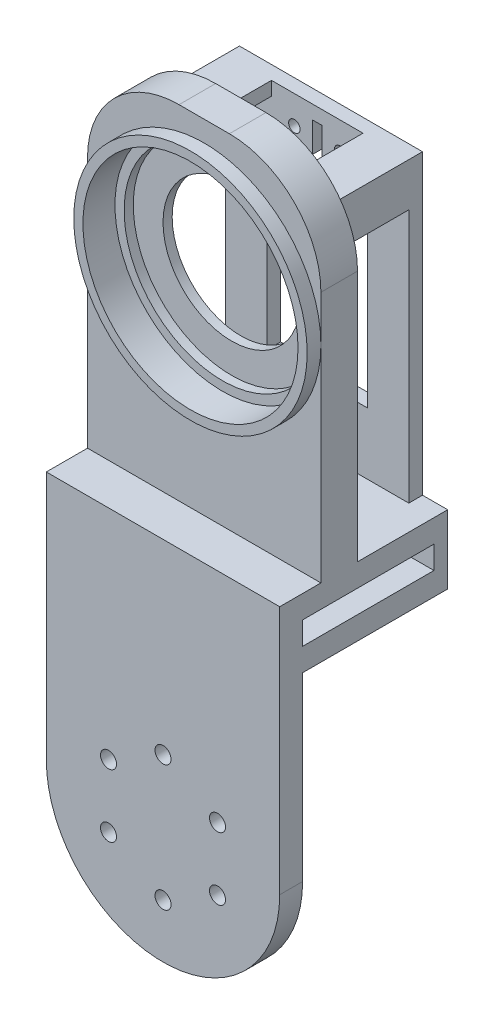
from build123d import *

# Parameters (mm, degrees)
EXTRUDE_1_DEPTH     = 5
SKETCH_2_R          = 17.5
CUT_EXTRUDE_1_DEPTH = 2
SKETCH_3_R          = 1.75
CUT_EXTRUDE_2_DEPTH = 61.245331769
SKETCH_4_W          = 51
SKETCH_4_H          = 5
EXTRUDE_2_DEPTH     = 31.7
SKETCH_12_W         = 51
SKETCH_12_H         = 8
EXTRUDE_7_DEPTH     = 75
FILLET_2_R          = 20
CUT_EXTRUDE_6_REACH = 135.449
SKETCH_13_R         = 15
SKETCH_14_R         = 25.5
EXTRUDE_8_DEPTH     = 3
SKETCH_16_R         = 23.5
CUT_EXTRUDE_7_DEPTH = 7
SKETCH_17_R         = 21.5
CUT_EXTRUDE_8_DEPTH = 2
EXTRUDE_9_DEPTH     = 19.7
EXTRUDE_10_DEPTH    = 3
CUT_EXTRUDE_9_REACH = 138.994
SKETCH_20_R         = 1.25


with BuildPart() as part:
    # 스케치1 → 보스-돌출1 (new body)
    with BuildSketch(Plane.XY):
        with BuildLine():
            Line((-25.5, 0), (-25.5, 54.5))
            Line((-25.5, 54.5), (25.5, 54.5))
            Line((25.5, 54.5), (25.5, 0))
            ThreePointArc((25.5, 0), (0, -25.5), (-25.5, 0))
        make_face()
    extrude(amount=EXTRUDE_1_DEPTH)

    # 스케치2 → 컷-돌출1 (cut)
    with BuildSketch(Plane(origin=(0, 0, 0), x_dir=(-1, 0, 0), z_dir=(0, 0, -1))):
        Circle(SKETCH_2_R)
    extrude(amount=-CUT_EXTRUDE_1_DEPTH, mode=Mode.SUBTRACT)

    # 스케치3 → 컷-돌출2 (cut, through all)
    with BuildSketch(Plane(origin=(0, 0, 2), x_dir=(-1, 0, 0), z_dir=(0, 0, -1))):
        with Locations((0, 13.75)):
            Circle(SKETCH_3_R)
        with Locations((11.907849302, 6.875)):
            Circle(SKETCH_3_R)
        with Locations((11.907849302, -6.875)):
            Circle(SKETCH_3_R)
        with Locations((0, -13.75)):
            Circle(SKETCH_3_R)
        with Locations((-11.907849302, -6.875)):
            Circle(SKETCH_3_R)
        with Locations((-11.907849302, 6.875)):
            Circle(SKETCH_3_R)
    extrude(amount=-CUT_EXTRUDE_2_DEPTH, mode=Mode.SUBTRACT)

    # 스케치4 → 보스-돌출2 (add)
    with BuildSketch(Plane(origin=(0, 0, 0), x_dir=(-1, 0, 0), z_dir=(0, 0, -1))):
        with Locations((0, 52)):
            Rectangle(SKETCH_4_W, SKETCH_4_H)
        with Locations((0, 42)):
            Rectangle(SKETCH_4_W, SKETCH_4_H)
    extrude(amount=EXTRUDE_2_DEPTH)

    # 스케치12 → 보스-돌출7 (add)
    with BuildSketch(Plane(origin=(0, 54.5, 0), x_dir=(1, 0, 0), z_dir=(0, 1, 0))):
        with Locations((0, 8)):
            Rectangle(SKETCH_12_W, SKETCH_12_H)
    extrude(amount=EXTRUDE_7_DEPTH)

    # 필렛2
    fillet_2_edges = [part.edges().sort_by_distance(p)[0] for p in [
        (-25.5, 129.5, -8),
        (25.5, 129.5, -8),
    ]]
    fillet(fillet_2_edges, radius=FILLET_2_R)

    # 스케치13 → 컷-돌출6 (cut, up to next)
    with BuildSketch(Plane(origin=(0, 0, -12), x_dir=(-1, 0, 0), z_dir=(0, 0, -1)), mode=Mode.PRIVATE) as cut_extrude_6_sk1:
        with Locations((0, 99.5)):
            Circle(SKETCH_13_R)
    cut_extrude_6_tool1 = extrude(cut_extrude_6_sk1.sketch, amount=-CUT_EXTRUDE_6_REACH, mode=Mode.PRIVATE) & part.part
    add(cut_extrude_6_tool1.solids().sort_by_distance((0, 99.5, -12))[0], mode=Mode.SUBTRACT)

    # 스케치14 → 보스-돌출8 (add)
    with BuildSketch(Plane.XY.offset(-4)):
        with Locations((0, 99.5)):
            Circle(SKETCH_14_R)
    extrude(amount=EXTRUDE_8_DEPTH)

    # 스케치16 → 컷-돌출7 (cut)
    with BuildSketch(Plane.XY.offset(-1)):
        with Locations((0, 99.5)):
            Circle(SKETCH_16_R)
    extrude(amount=-CUT_EXTRUDE_7_DEPTH, mode=Mode.SUBTRACT)

    # 스케치17 → 컷-돌출8 (cut)
    with BuildSketch(Plane.XY.offset(-8)):
        with Locations((0, 99.5)):
            Circle(SKETCH_17_R)
    extrude(amount=-CUT_EXTRUDE_8_DEPTH, mode=Mode.SUBTRACT)

    # 스케치18 → 보스-돌출9 (add)
    with BuildSketch(Plane(origin=(0, 0, -12), x_dir=(-1, 0, 0), z_dir=(0, 0, -1))):
        Polygon((-20, 119.5), (-10, 119.5), (-10, 116.5), (-17, 116.5), (-17, 110), (-20, 110), align=None)
        Polygon((20, 119.5), (10, 119.5), (10, 116.5), (17, 116.5), (17, 110), (20, 110), align=None)
    extrude(amount=EXTRUDE_9_DEPTH)

    # 스케치19 → 보스-돌출10 (add)
    with BuildSketch(Plane(origin=(0, 0, -31.7), x_dir=(-1, 0, 0), z_dir=(0, 0, -1))):
        Polygon((-20, 119.5), (20, 119.5), (20, 54.5), (25.5, 54.5), (25.5, 39.5), (-25.5, 39.5), (-25.5, 54.5), (-20, 54.5), align=None)
    extrude(amount=-EXTRUDE_10_DEPTH)

    # 스케치20 → 컷-돌출9 (cut, up to next)
    with BuildSketch(Plane(origin=(0, 0, -31.7), x_dir=(-1, 0, 0), z_dir=(0, 0, -1)), mode=Mode.PRIVATE) as cut_extrude_9_sk1:
        with Locations((-5, 113.35)):
            Circle(SKETCH_20_R)
    cut_extrude_9_tool1 = extrude(cut_extrude_9_sk1.sketch, amount=-CUT_EXTRUDE_9_REACH, mode=Mode.PRIVATE) & part.part
    # 스케치20 → 컷-돌출9 (cut, up to next)
    with BuildSketch(Plane(origin=(0, 0, -31.7), x_dir=(-1, 0, 0), z_dir=(0, 0, -1)), mode=Mode.PRIVATE) as cut_extrude_9_sk2:
        with Locations((5, 113.35)):
            Circle(SKETCH_20_R)
    cut_extrude_9_tool2 = extrude(cut_extrude_9_sk2.sketch, amount=-CUT_EXTRUDE_9_REACH, mode=Mode.PRIVATE) & part.part
    # 스케치20 → 컷-돌출9 (cut, up to next)
    with BuildSketch(Plane(origin=(0, 0, -31.7), x_dir=(-1, 0, 0), z_dir=(0, 0, -1)), mode=Mode.PRIVATE) as cut_extrude_9_sk3:
        with Locations((-5, 64.75)):
            Circle(SKETCH_20_R)
    cut_extrude_9_tool3 = extrude(cut_extrude_9_sk3.sketch, amount=-CUT_EXTRUDE_9_REACH, mode=Mode.PRIVATE) & part.part
    # 스케치20 → 컷-돌출9 (cut, up to next)
    with BuildSketch(Plane(origin=(0, 0, -31.7), x_dir=(-1, 0, 0), z_dir=(0, 0, -1)), mode=Mode.PRIVATE) as cut_extrude_9_sk4:
        with Locations((5, 64.75)):
            Circle(SKETCH_20_R)
    cut_extrude_9_tool4 = extrude(cut_extrude_9_sk4.sketch, amount=-CUT_EXTRUDE_9_REACH, mode=Mode.PRIVATE) & part.part
    # 스케치20 → 컷-돌출9 (cut, up to next)
    with BuildSketch(Plane(origin=(0, 0, -31.7), x_dir=(-1, 0, 0), z_dir=(0, 0, -1)), mode=Mode.PRIVATE) as cut_extrude_9_sk5:
        Polygon((1, 110), (11, 110), (11, 68), (1, 68), (1, 61.5), (-1, 61.5), (-1, 68), (-11, 68), (-11, 110), (-1, 110), (-1, 116.5), (1, 116.5), align=None)
    cut_extrude_9_tool5 = extrude(cut_extrude_9_sk5.sketch, amount=-CUT_EXTRUDE_9_REACH, mode=Mode.PRIVATE) & part.part
    add(cut_extrude_9_tool1.solids().sort_by_distance((5, 113.35, -31.7))[0], mode=Mode.SUBTRACT)
    add(cut_extrude_9_tool2.solids().sort_by_distance((-5, 113.35, -31.7))[0], mode=Mode.SUBTRACT)
    add(cut_extrude_9_tool3.solids().sort_by_distance((5, 64.75, -31.7))[0], mode=Mode.SUBTRACT)
    add(cut_extrude_9_tool4.solids().sort_by_distance((-5, 64.75, -31.7))[0], mode=Mode.SUBTRACT)
    add(cut_extrude_9_tool5.solids().sort_by_distance((0, 89, -31.7))[0], mode=Mode.SUBTRACT)


solid = part.part
